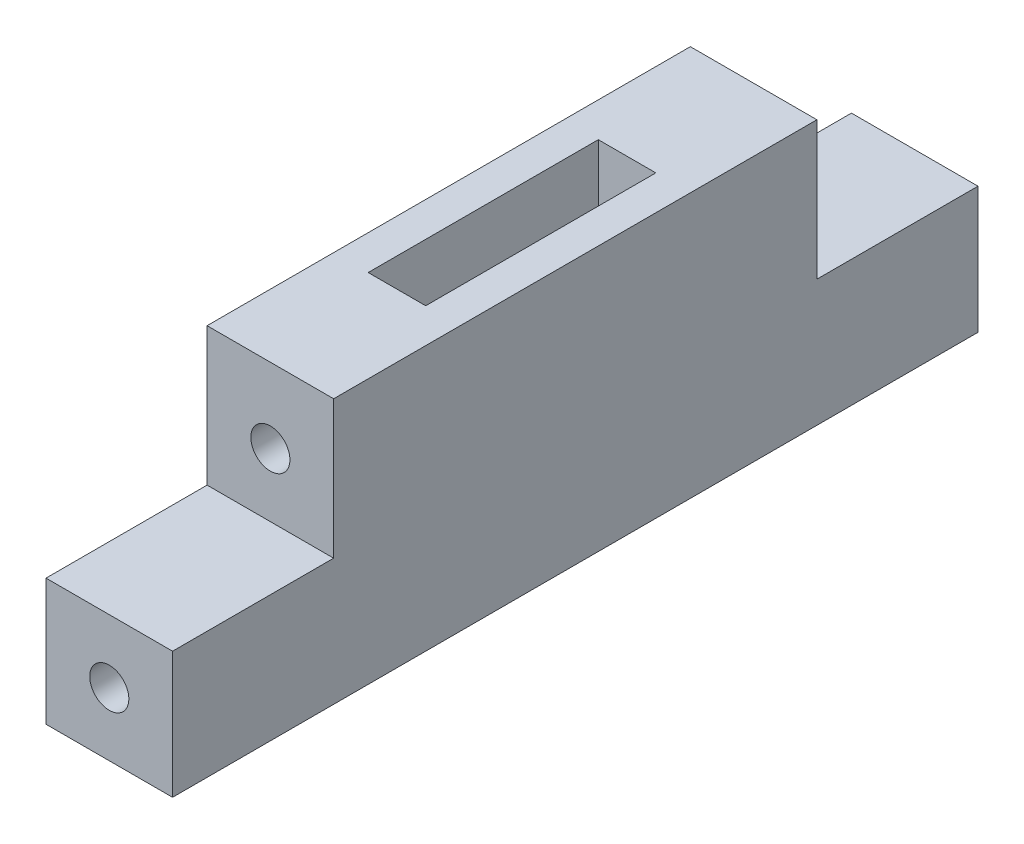
from build123d import *

# Parameters (mm, degrees)
SKETCH1_W           = 11
SKETCH1_H           = 11
BOSS_EXTRUDE1_DEPTH = 70
SKETCH2_W           = 11
SKETCH2_H           = 42
BOSS_EXTRUDE2_DEPTH = 12
SKETCH3_W           = 5
SKETCH3_H           = 20
CUT_EXTRUDE1_DEPTH  = 10
CUT_EXTRUDE2_REACH  = 63.53
SKETCH4_R           = 1.7
SKETCH5_W           = 5
SKETCH5_H           = 2
CUT_EXTRUDE3_DEPTH  = 8
SKETCH6_R           = 1.7
CUT_EXTRUDE4_DEPTH  = 17
CUT_EXTRUDE5_START  = -17
SKETCH8_R           = 1.7
CUT_EXTRUDE5_DEPTH  = 17


with BuildPart() as part:
    # Sketch1 → Boss-Extrude1 (new body)
    with BuildSketch(Plane.XY):
        with Locations((5.5, 5.5)):
            Rectangle(SKETCH1_W, SKETCH1_H)
    extrude(amount=BOSS_EXTRUDE1_DEPTH)

    # Sketch2 → Boss-Extrude2 (add)
    with BuildSketch(Plane(origin=(0, 11, 0), x_dir=(1, 0, 0), z_dir=(0, 1, 0))):
        with Locations((5.5, -35)):
            Rectangle(SKETCH2_W, SKETCH2_H)
    extrude(amount=BOSS_EXTRUDE2_DEPTH)

    # Sketch3 → Cut-Extrude1 (cut)
    with BuildSketch(Plane(origin=(0, 23, 0), x_dir=(1, 0, 0), z_dir=(0, 1, 0))):
        with Locations((5.5, -35)):
            Rectangle(SKETCH3_W, SKETCH3_H)
    extrude(amount=-CUT_EXTRUDE1_DEPTH, mode=Mode.SUBTRACT)

    # Cut-Extrude2: up to this face of the body (flat: up to its plane)
    cut_extrude2_end = Plane(part.part.faces().sort_by_distance((5.5, 17, 56))[0])
    # Sketch4 → Cut-Extrude2 (cut, up to the picked face)
    with BuildSketch(Plane(origin=(0, 0, 14), x_dir=(-1, 0, 0), z_dir=(0, 0, -1)), mode=Mode.PRIVATE) as cut_extrude2_sk1:
        with Locations((-5.5, 16.5)):
            Circle(SKETCH4_R)
    cut_extrude2_tool1 = split(extrude(cut_extrude2_sk1.sketch, amount=-CUT_EXTRUDE2_REACH, mode=Mode.PRIVATE), bisect_by=cut_extrude2_end, keep=Keep.BOTH, mode=Mode.PRIVATE)
    add(cut_extrude2_tool1.solids().sort_by(Axis((5.5, 16.5, 14), (0, 0, 1)))[0], mode=Mode.SUBTRACT)

    # Sketch5 → Cut-Extrude3 (cut)
    with BuildSketch(Plane.XZ):
        with Locations((5.5, 55)):
            Rectangle(SKETCH5_W, SKETCH5_H)
        with Locations((5.5, 15)):
            Rectangle(SKETCH5_W, SKETCH5_H)
    extrude(amount=-CUT_EXTRUDE3_DEPTH, mode=Mode.SUBTRACT)

    # Sketch6 → Cut-Extrude4 (cut)
    with BuildSketch(Plane(origin=(0, 0, 0), x_dir=(-1, 0, 0), z_dir=(0, 0, -1))):
        with Locations((-5.5, 5.5)):
            Circle(SKETCH6_R)
    extrude(amount=-CUT_EXTRUDE4_DEPTH, mode=Mode.SUBTRACT)

    # Sketch8 → Cut-Extrude5 (cut)
    with BuildSketch(Plane.XY.offset(70).offset(CUT_EXTRUDE5_START)):
        with Locations(Location((5.5, 5.5, 0), (0, 0, 180))):
            Circle(SKETCH8_R)
    extrude(amount=CUT_EXTRUDE5_DEPTH, mode=Mode.SUBTRACT)


solid = part.part
